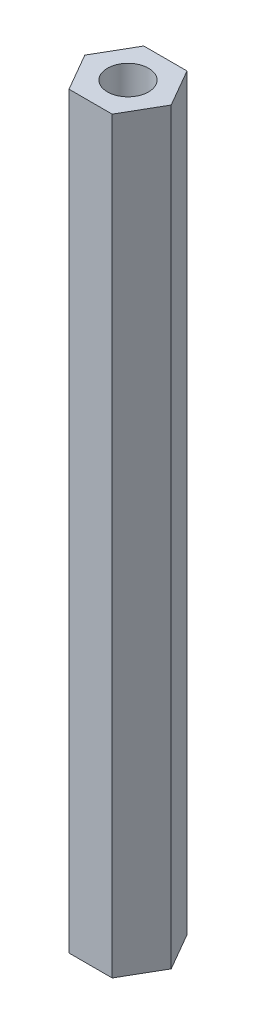
from build123d import *

# Parameters (mm, degrees)
EXTRUDE_1_DEPTH = 30


with BuildPart() as part:
    # 草图1 → 凸台-拉伸1 (new, symmetric)
    with BuildSketch(Plane(origin=(0, 0, 0), x_dir=(1, 0, 0), z_dir=(0, 1, 0))):
        Polygon((3.464101615, 0), (1.732050808, 3), (-1.732050808, 3), (-3.464101615, 0), (-1.732050808, -3), (1.732050808, -3), align=None)
    extrude(amount=EXTRUDE_1_DEPTH, both=True)

    # 草图3 → M4 螺纹孔1 (revolve, cut)
    with BuildSketch(Plane(origin=(0, 30, 0), x_dir=(0, 0, 1), z_dir=(1, 0, 0))):
        Polygon((0, 0), (0, 11.091420021), (1.65, 10.1), (1.65, 0), align=None)
    hole_wizard_m4_1 = revolve(axis=Axis((0, 36.35, 0), (0, -1, 0)), mode=Mode.SUBTRACT)

    # 镜向1: M4 螺纹孔1 across plane
    add(hole_wizard_m4_1.mirror(Plane.ZX), mode=Mode.SUBTRACT)


solid = part.part
